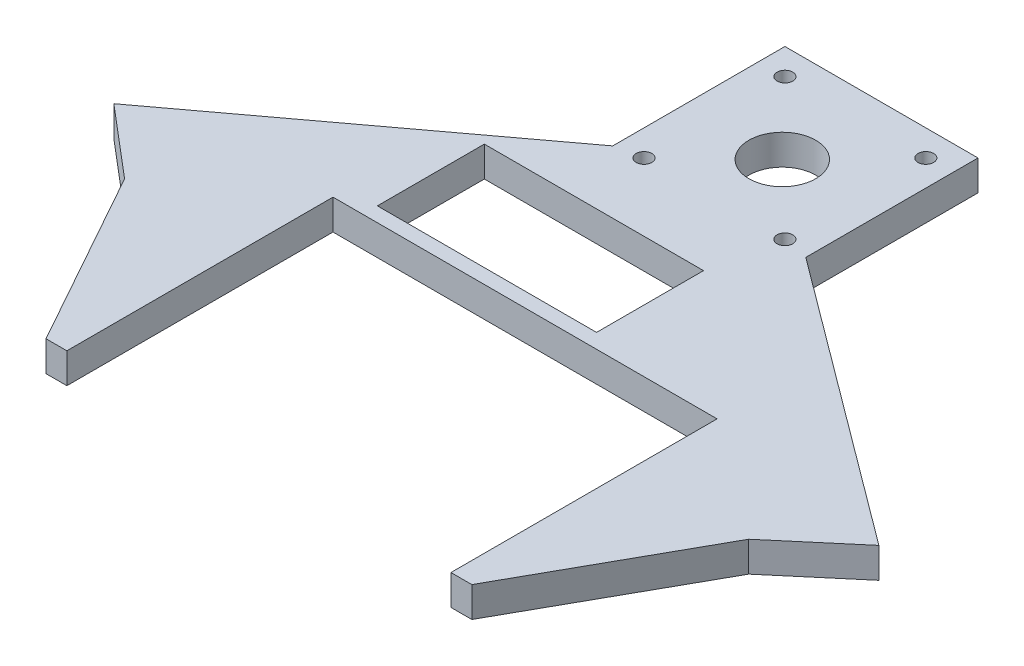
from build123d import *
from build123d.topology import SkipClean

# Parameters (mm, degrees)
BOSS_EXTRU_1_DEPTH      = 5.8
ESQUISSE2_R             = 1.5
ESQUISSE2_R_2           = 6.4
ENL_V_MAT_EXTRU_1_DEPTH = 5.8
ESQUISSE3_W             = 42
ESQUISSE3_H             = 20.5
ENL_V_MAT_EXTRU_2_DEPTH = 5.8


with BuildPart() as part:
    # Esquisse1 → Boss.-Extru.1 (new body)
    with BuildSketch(Plane(origin=(0, 0, 0), x_dir=(1, 0, 0), z_dir=(0, 1, 0))):
        Polygon((0, 0), (-18.5, 0), (-18.5, -33), (-73.3, -73.793956851), (-59.8, -85.241227268), (-40.8, -119.3), (-36.8, -119.3), (-36.8, -68.3), (0, -68.3), align=None)
    boss_extru_1 = extrude(amount=BOSS_EXTRU_1_DEPTH)

    # Esquisse2 → Enlèv. mat.-Extru.1 (cut)
    with BuildSketch(Plane(origin=(0, 5.8, 0), x_dir=(1, 0, 0), z_dir=(0, 1, 0))):
        with Locations(Location((-13.5, -5, 0), (0, 0, 270))):
            Circle(ESQUISSE2_R)
        with Locations((0, -19)):
            Circle(ESQUISSE2_R_2)
        with Locations(Location((-13.5, -32, 0), (0, 0, 270))):
            Circle(ESQUISSE2_R)
    enl_v_mat_extru_1 = extrude(amount=-ENL_V_MAT_EXTRU_1_DEPTH, mode=Mode.SUBTRACT)

    # Symétrie2: Boss.-Extru.1, Enlèv. mat.-Extru.1 across plane
    with SkipClean():  # the faces are left unmerged after this step: merging them gives an invalid solid
        add(boss_extru_1.mirror(Plane(origin=(0, 5.8, 68.3), x_dir=(0, 0, 1), z_dir=(-1, 0, 0))))
        add(enl_v_mat_extru_1.mirror(Plane(origin=(0, 5.8, 68.3), x_dir=(0, 0, 1), z_dir=(-1, 0, 0))), mode=Mode.SUBTRACT)

    # Esquisse3 → Enlèv. mat.-Extru.2 (cut)
    with SkipClean():  # the faces are left unmerged after this step: merging them gives an invalid solid
        with BuildSketch(Plane(origin=(0, 5.8, 0), x_dir=(1, 0, 0), z_dir=(0, 1, 0))):
            with Locations((-10.1, -55.25)):
                Rectangle(ESQUISSE3_W, ESQUISSE3_H)
        extrude(amount=-ENL_V_MAT_EXTRU_2_DEPTH, mode=Mode.SUBTRACT)


solid = part.part
